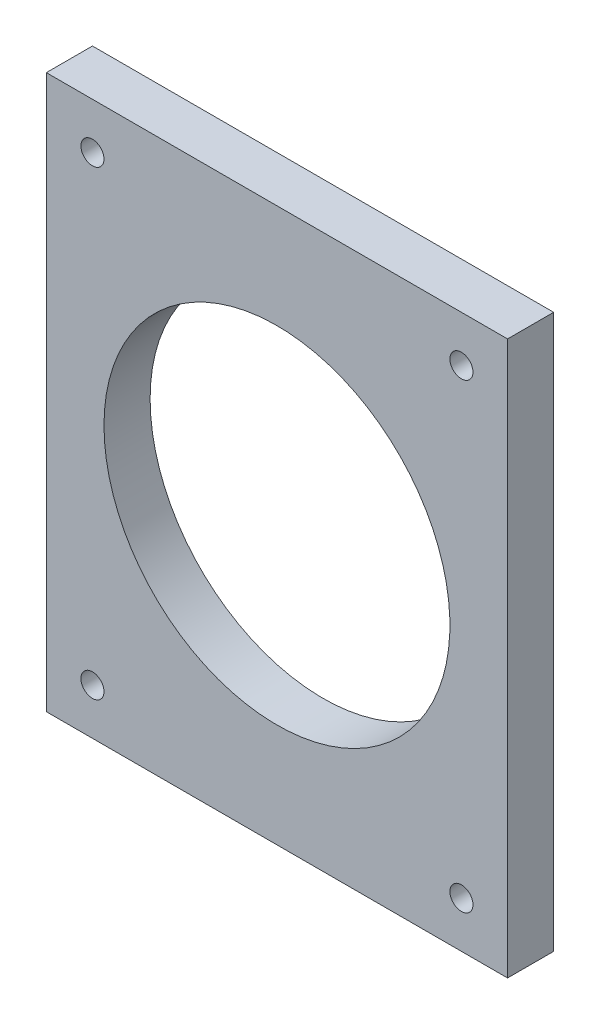
from build123d import *

# Parameters (mm, degrees)
SKETCH1_W               = 127
SKETCH1_H               = 152.4
BOSS_EXTRUDE1_DEPTH     = 12.7
SKETCH2_R               = 47.625
CUT_EXTRUDE1_DEPTH      = 100.9999
CUT_EXTRUDE3_DEPTH      = 100.9999
CUT_EXTRUDE3_DEPTH_BACK = 100.9999
SKETCH3_R               = 3.175


with BuildPart() as part:
    # Sketch1 → Boss-Extrude1 (new body)
    with BuildSketch(Plane.XY):
        Rectangle(SKETCH1_W, SKETCH1_H)
    extrude(amount=BOSS_EXTRUDE1_DEPTH)

    # Sketch2 → Cut-Extrude1 (cut, through all)
    with BuildSketch(Plane(origin=(0, 0, 0), x_dir=(-1, 0, 0), z_dir=(0, 0, -1))):
        Circle(SKETCH2_R)
    extrude(amount=-CUT_EXTRUDE1_DEPTH, mode=Mode.SUBTRACT)

    # Sketch3 → Cut-Extrude3 (cut, two sides: drawn at the far end of the back side and taken through both)
    with BuildSketch(Plane(origin=(0, 0, 0), x_dir=(-1, 0, 0), z_dir=(0, 0, -1)).offset(-CUT_EXTRUDE3_DEPTH_BACK)):
        with Locations((-50.8, 63.5)):
            Circle(SKETCH3_R)
        with Locations((50.8, 63.5)):
            Circle(SKETCH3_R)
        with Locations((50.8, -63.5)):
            Circle(SKETCH3_R)
        with Locations((-50.8, -63.5)):
            Circle(SKETCH3_R)
    extrude(amount=CUT_EXTRUDE3_DEPTH + CUT_EXTRUDE3_DEPTH_BACK, mode=Mode.SUBTRACT)


solid = part.part
